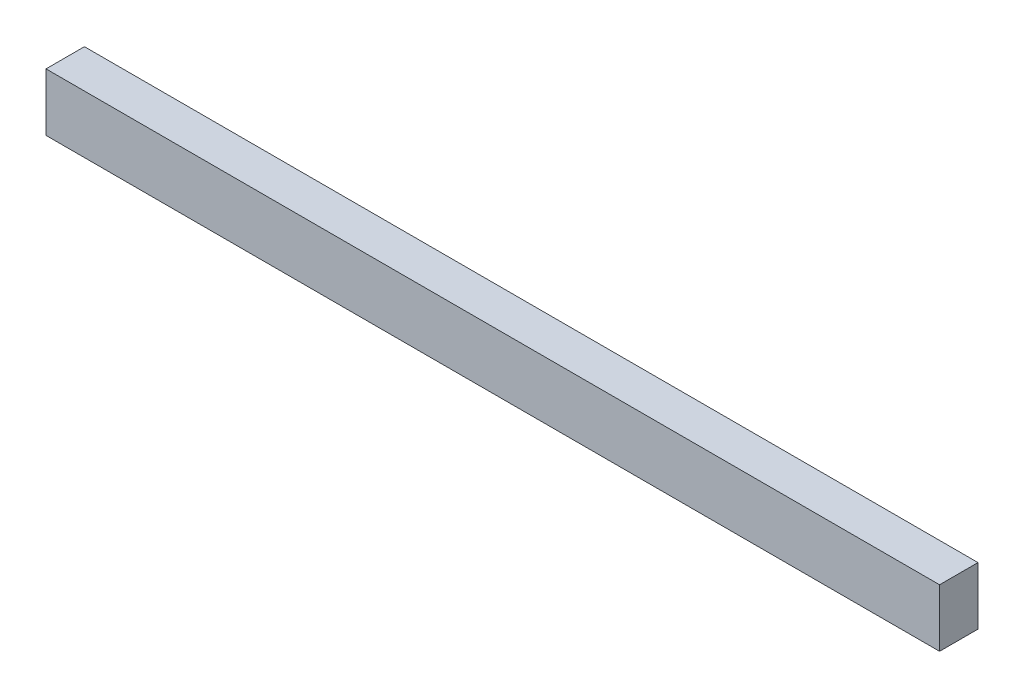
from build123d import *

# Parameters (mm, degrees)
SKETCH1_W                     = 590.55
SKETCH1_H                     = 25.4
BOSS_EXTRUDE1_DEPTH           = 38.1
F_94_0_3_DIAMETER_HOLE1_D     = 7.62
F_94_0_3_DIAMETER_HOLE1_DEPTH = 25.4
F_94_0_3_DIAMETER_HOLE1_TIP   = 2.289278958


with BuildPart() as part:
    # Sketch1 → Boss-Extrude1 (new body)
    with BuildSketch(Plane(origin=(0, 0, 0), x_dir=(1, 0, 0), z_dir=(0, 1, 0))):
        Rectangle(SKETCH1_W, SKETCH1_H)
    extrude(amount=BOSS_EXTRUDE1_DEPTH)

    # #94 (0.3) Diameter Hole1
    with Locations(Plane.XZ):
        with Locations((269.875, 6.35), (212.725, 6.35), (155.575, 6.35), (-142.875, 6.35), (98.425, 6.35), (41.275, 6.35), (-15.875, 6.35), (-200.025, 6.35), (-257.175, 6.35)):
            Hole(F_94_0_3_DIAMETER_HOLE1_D / 2, depth=F_94_0_3_DIAMETER_HOLE1_DEPTH)
            with Locations((0, 0, -(F_94_0_3_DIAMETER_HOLE1_DEPTH + F_94_0_3_DIAMETER_HOLE1_TIP / 2))):  # 118° drill point
                Cone(0, F_94_0_3_DIAMETER_HOLE1_D / 2, F_94_0_3_DIAMETER_HOLE1_TIP, mode=Mode.SUBTRACT)


solid = part.part
